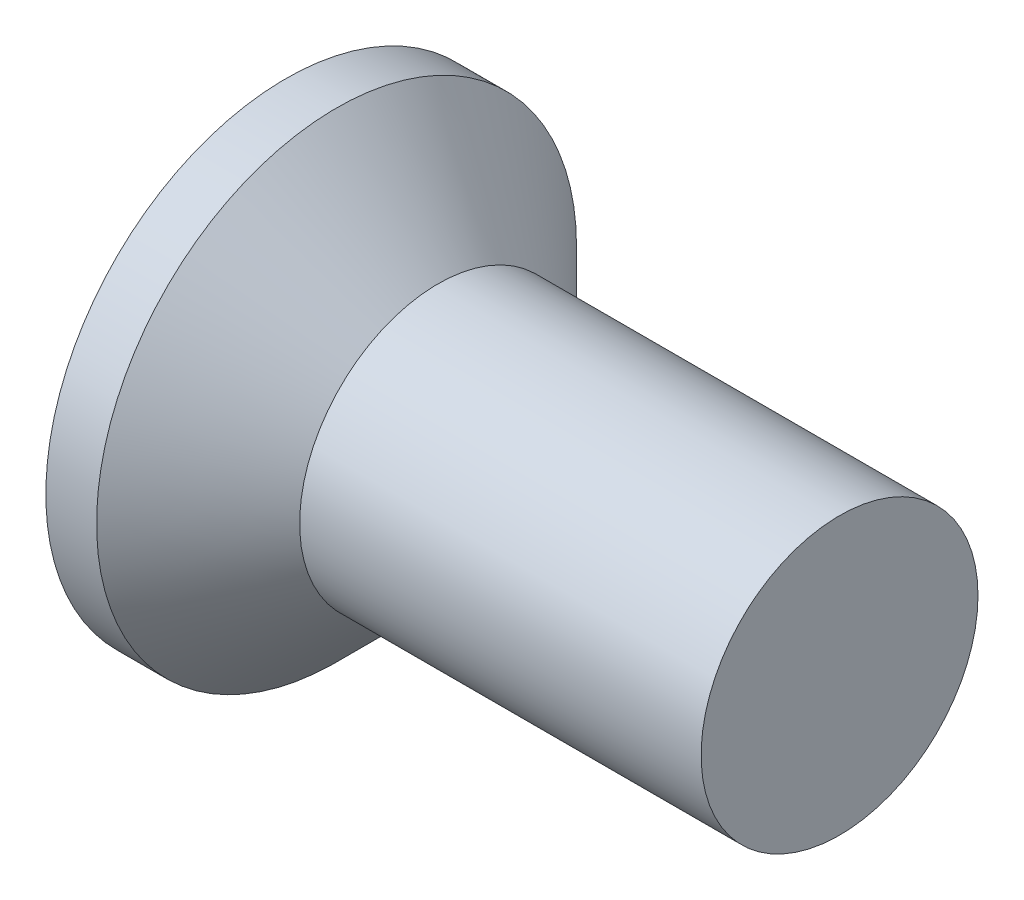
from build123d import *

# Parameters (mm, degrees)
CROSSRECESS_DEPTH = 0.825
DRAFT9_ANGLE      = 30
FILLET5_R         = 0.3


with BuildPart() as part:
    # Sketch1 → Base (revolve)
    with BuildSketch(Plane.XY, mode=Mode.PRIVATE) as base_sk:
        Polygon((6, 1.5), (2.65, 1.5), (1.65, 1.5), (0.55, 2.6), (0, 2.6), (0, 0), (6, 0), align=None)
    revolve(base_sk.sketch.rotate(Axis((4.515812911, 0, 0), (-1, 0, 0)), 90), axis=Axis((4.515812911, 0, 0), (-1, 0, 0)))

    # Sketch6 → CrossRecess (cut)
    with BuildSketch(Plane(origin=(0, 0, 0), x_dir=(0, 0, -1), z_dir=(1, 0, 0))):
        Polygon((0.32, 0.32), (0.32, 1.6), (-0.32, 1.6), (-0.32, 0.32), (-1.6, 0.32), (-1.6, -0.32), (-0.32, -0.32), (-0.32, -1.6), (0.32, -1.6), (0.32, -0.32), (1.6, -0.32), (1.6, 0.32), align=None)
    extrude(amount=CROSSRECESS_DEPTH, mode=Mode.SUBTRACT)

    # Draft9
    draft9_faces = [part.faces().sort_by_distance(p)[0] for p in [
        (0.4125, 1.6, 0),
        (0.4125, 0, 1.6),
        (0.4125, -1.6, 0),
        (0.4125, 0, -1.6),
    ]]
    draft(draft9_faces, Plane(origin=(0, 2.6, 0), x_dir=(0, 0, -1), z_dir=(-1, 0, 0)), DRAFT9_ANGLE)

    # Fillet5
    fillet5_edges = [part.edges().sort_by_distance(p)[0] for p in [
        (0.4125, 0.32, 0.32),
        (0.4125, -0.32, 0.32),
        (0.4125, -0.32, -0.32),
        (0.4125, 0.32, -0.32),
    ]]
    fillet(fillet5_edges, radius=FILLET5_R)


solid = part.part
